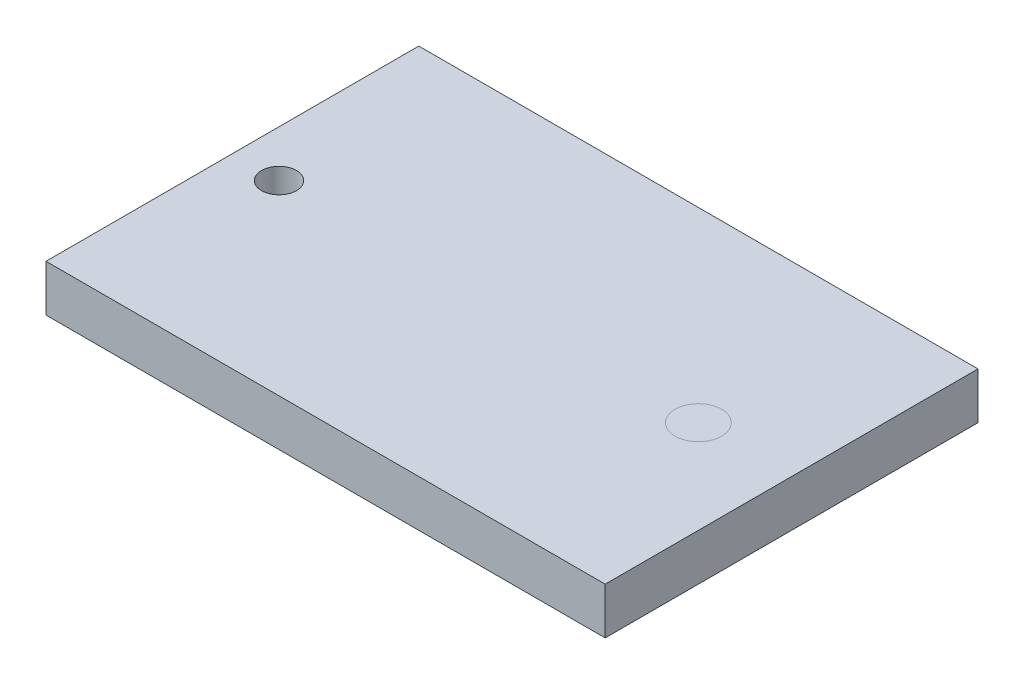
from build123d import *

# Parameters (mm, degrees)
SKETCH1_W           = 76.2
SKETCH1_H           = 50.8
SKETCH1_R           = 2.38125
BOSS_EXTRUDE1_DEPTH = 6.35


with BuildPart() as part:
    # Sketch1 → Boss-Extrude1 (new body)
    with BuildSketch(Plane(origin=(0, 0, 0), x_dir=(1, 0, 0), z_dir=(0, 1, 0))):
        Rectangle(SKETCH1_W, SKETCH1_H)
        with Locations((-31.75, 0)):
            Circle(SKETCH1_R, mode=Mode.SUBTRACT)
    extrude(amount=BOSS_EXTRUDE1_DEPTH)


solid = part.part
